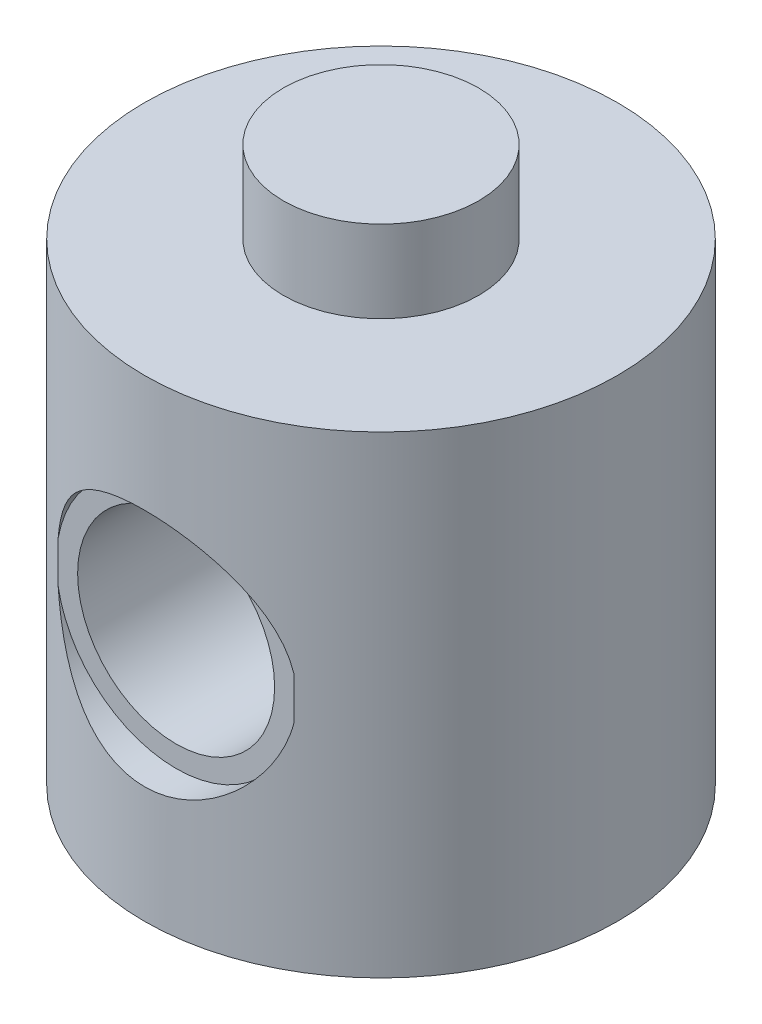
from build123d import *

# Parameters (mm, degrees)
SKETCH9_R                        = 4.826
CUT_EXTRUDE1_DEPTH               = 1.27
SKETCH10_W                       = 3.96875
SKETCH10_H                       = 17.78
F_3_8_16_TAPPED_HOLE2_AT_2_COUNT = 2
F_3_8_16_TAPPED_HOLE2_AT_2_PITCH = 29.889478418


with BuildPart() as part:
    # Sketch4 → Revolve1 (revolve)
    with BuildSketch(Plane.XY, mode=Mode.PRIVATE) as revolve1_sk:
        Polygon((0, 0), (3.937, 0), (3.937, -3.302), (9.525, -3.302), (9.525, -22.352), (3.937, -22.352), (3.937, -25.654), (0, -25.654), align=None)
    revolve(revolve1_sk.sketch.rotate(Axis((0, -25.654, 0), (0, 1, 0)), 90), axis=Axis((0, -25.654, 0), (0, 1, 0)))

    # Sketch9 → Cut-Extrude1 (cut)
    with BuildSketch(Plane.XY.offset(9.525)):
        with Locations((0, -12.827)):
            Circle(SKETCH9_R)
    extrude(amount=-CUT_EXTRUDE1_DEPTH, mode=Mode.SUBTRACT)

    # Sketch10 → 3/8-16 Tapped Hole2 (revolve, cut)
    with BuildSketch(Plane(origin=(0, -12.827, 8.255), x_dir=(0, -1, 0), z_dir=(1, 0, 0))):
        with Locations((1.984375, 8.89)):
            Rectangle(SKETCH10_W, SKETCH10_H)
    f_3_8_16_tapped_hole2 = revolve(axis=Axis((0, -12.827, 14.605), (0, 0, -1)), mode=Mode.SUBTRACT)

    # 3/8-16 Tapped Hole2 at 2: 3/8-16 Tapped Hole2 ×2
    with Locations(*[Vector(0.9929520890622513, 0.11851644960473202, 0) * (i * F_3_8_16_TAPPED_HOLE2_AT_2_PITCH) for i in range(1, F_3_8_16_TAPPED_HOLE2_AT_2_COUNT)]):
        add(f_3_8_16_tapped_hole2, mode=Mode.SUBTRACT)


solid = part.part
